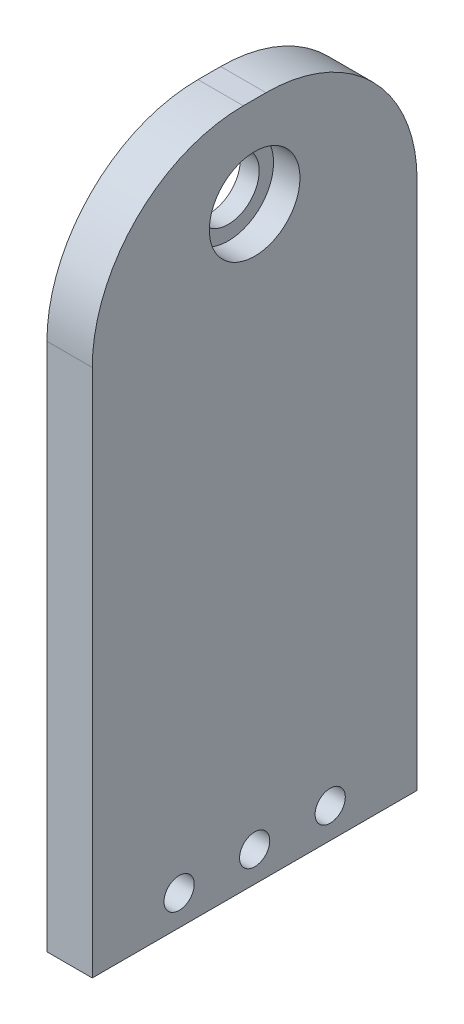
from build123d import *

# Parameters (mm, degrees)
SKETCH1_W           = 43
SKETCH1_H           = 90
BOSS_EXTRUDE1_DEPTH = 6
CUT_EXTRUDE1_REACH  = 52.232
SKETCH2_R           = 2
CUT_EXTRUDE2_REACH  = 52.232
SKETCH3_R           = 4.1
FILLET1_R           = 20
SKETCH4_R           = 6
CUT_EXTRUDE3_DEPTH  = 3.5


with BuildPart() as part:
    # Sketch1 → Boss-Extrude1 (new body)
    with BuildSketch(Plane(origin=(0, 0, 0), x_dir=(0, 0, -1), z_dir=(1, 0, 0))):
        Rectangle(SKETCH1_W, SKETCH1_H)
    extrude(amount=BOSS_EXTRUDE1_DEPTH)

    # Sketch2 → Cut-Extrude1 (cut, up to next)
    with BuildSketch(Plane(origin=(6, 0, 0), x_dir=(0, 0, -1), z_dir=(1, 0, 0)), mode=Mode.PRIVATE) as cut_extrude1_sk1:
        with Locations((0, -41)):
            Circle(SKETCH2_R)
    cut_extrude1_tool1 = extrude(cut_extrude1_sk1.sketch, amount=-CUT_EXTRUDE1_REACH, mode=Mode.PRIVATE) & part.part
    # Sketch2 → Cut-Extrude1 (cut, up to next)
    with BuildSketch(Plane(origin=(6, 0, 0), x_dir=(0, 0, -1), z_dir=(1, 0, 0)), mode=Mode.PRIVATE) as cut_extrude1_sk2:
        with Locations((10, -41)):
            Circle(SKETCH2_R)
    cut_extrude1_tool2 = extrude(cut_extrude1_sk2.sketch, amount=-CUT_EXTRUDE1_REACH, mode=Mode.PRIVATE) & part.part
    # Sketch2 → Cut-Extrude1 (cut, up to next)
    with BuildSketch(Plane(origin=(6, 0, 0), x_dir=(0, 0, -1), z_dir=(1, 0, 0)), mode=Mode.PRIVATE) as cut_extrude1_sk3:
        with Locations((-10, -41)):
            Circle(SKETCH2_R)
    cut_extrude1_tool3 = extrude(cut_extrude1_sk3.sketch, amount=-CUT_EXTRUDE1_REACH, mode=Mode.PRIVATE) & part.part
    add(cut_extrude1_tool1.solids().sort_by_distance((6, -41, 0))[0], mode=Mode.SUBTRACT)
    add(cut_extrude1_tool2.solids().sort_by_distance((6, -41, -10))[0], mode=Mode.SUBTRACT)
    add(cut_extrude1_tool3.solids().sort_by_distance((6, -41, 10))[0], mode=Mode.SUBTRACT)

    # Sketch3 → Cut-Extrude2 (cut, up to next)
    with BuildSketch(Plane(origin=(6, 0, 0), x_dir=(0, 0, -1), z_dir=(1, 0, 0)), mode=Mode.PRIVATE) as cut_extrude2_sk1:
        with Locations((0, 33)):
            Circle(SKETCH3_R)
    cut_extrude2_tool1 = extrude(cut_extrude2_sk1.sketch, amount=-CUT_EXTRUDE2_REACH, mode=Mode.PRIVATE) & part.part
    add(cut_extrude2_tool1.solids().sort_by_distance((6, 33, 0))[0], mode=Mode.SUBTRACT)

    # Fillet1
    fillet1_edges = [part.edges().sort_by_distance(p)[0] for p in [
        (3, 45, 21.5),
        (3, 45, -21.5),
    ]]
    fillet(fillet1_edges, radius=FILLET1_R)

    # Sketch4 → Cut-Extrude3 (cut)
    with BuildSketch(Plane(origin=(6, 0, 0), x_dir=(0, 0, -1), z_dir=(1, 0, 0))):
        with Locations((0, 33)):
            Circle(SKETCH4_R)
    extrude(amount=-CUT_EXTRUDE3_DEPTH, mode=Mode.SUBTRACT)


solid = part.part
